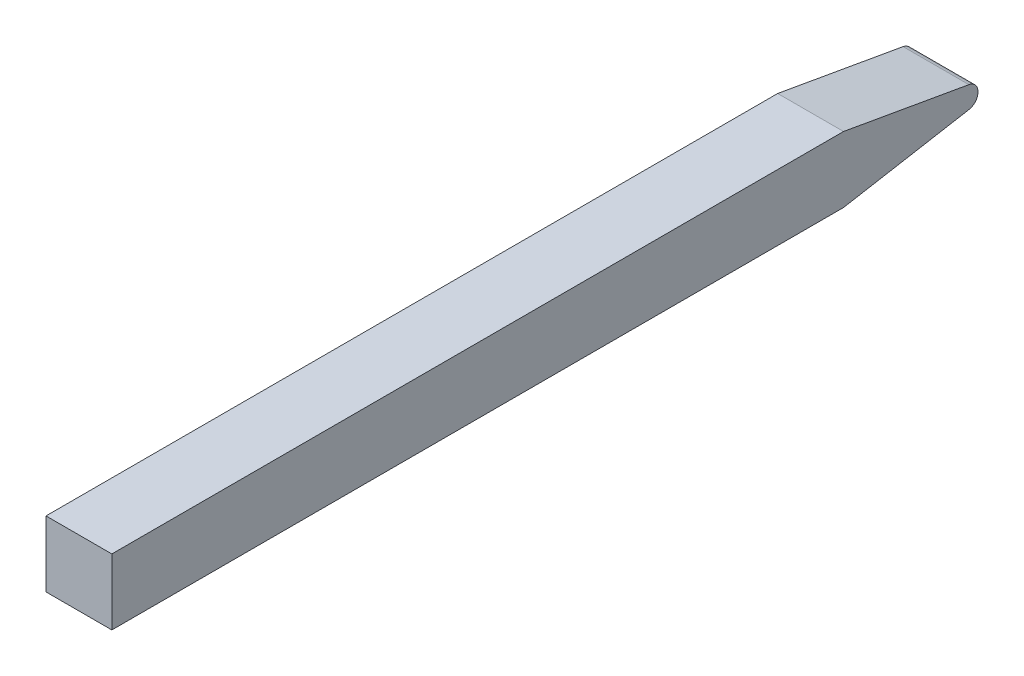
from build123d import *

# Parameters (mm, degrees)
BOSS_EXTRUDE1_DEPTH = 0.45
FILLET1_R           = 0.15


with BuildPart() as part:
    # Sketch1 → Boss-Extrude1 (new, symmetric)
    with BuildSketch(Plane(origin=(0, 0, 0), x_dir=(0, 0, -1), z_dir=(1, 0, 0))):
        Polygon((0, 0), (2.552076819, 0.45), (0, 0.9), (-10, 0.9), (-10, 0), align=None)
    extrude(amount=BOSS_EXTRUDE1_DEPTH, both=True)

    # Fillet1
    fillet1_edges = [part.edges().sort_by_distance(p)[0] for p in [
        (0, 0.45, -2.552076819),
    ]]
    fillet(fillet1_edges, radius=FILLET1_R)


solid = part.part
